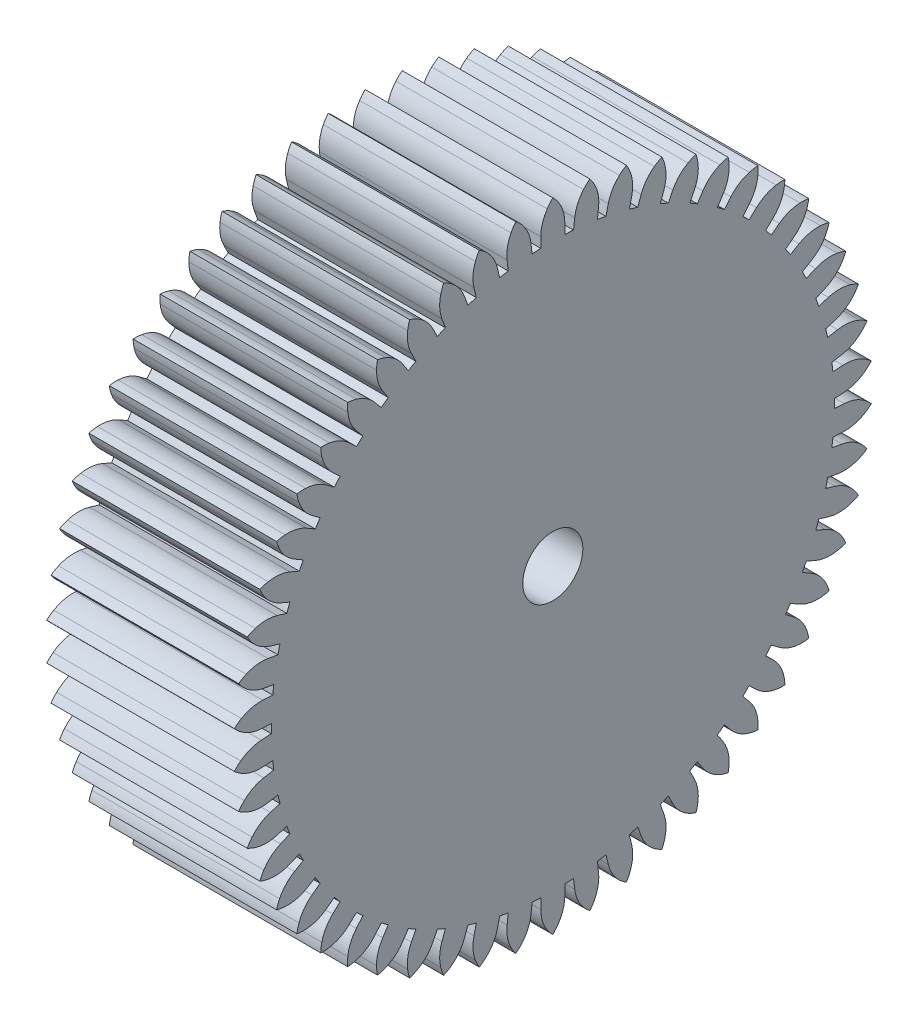
from build123d import *

# Parameters (mm, degrees)
BOSS_EXTRUDE1_DEPTH = 10
SKETCH2_R           = 1.6
CUT_EXTRUDE1_DEPTH  = 27.019664538


with BuildPart() as part:
    # Sketch1 → Boss-Extrude1 (new body)
    with BuildSketch(Plane(origin=(0, 0, 0), x_dir=(0, 0, -1), z_dir=(1, 0, 0))):
        with BuildLine():
            Line((-0.64, 14.986340447), (-0.64, 15.524222351))
            ThreePointArc((-0.64, 15.524222351), (-0.552634018, 16.1088856), (-0.298168885, 16.64246917))
            ThreePointArc((-0.298168885, 16.64246917), (-0.158190031, 16.828828344), (0, 17))
            ThreePointArc((0, 17), (0.158190031, 16.828828344), (0.298168885, 16.64246917))
            ThreePointArc((0.298168885, 16.64246917), (0.552634018, 16.1088856), (0.64, 15.524222351))
            Line((0.64, 15.524222351), (0.64, 14.986340447))
            ThreePointArc((0.64, 14.986340447), (0.872172434, 14.974622374), (1.104135386, 14.959307639))
            Line((1.104135386, 14.959307639), (1.166579663, 15.493552578))
            ThreePointArc((1.166579663, 15.493552578), (1.321230169, 16.064119972), (1.63591997, 16.564554042))
            ThreePointArc((1.63591997, 16.564554042), (1.796587317, 16.733402569), (1.97357954, 16.885052082))
            ThreePointArc((1.97357954, 16.885052082), (2.11082813, 16.696673086), (2.228225518, 16.495323452))
            ThreePointArc((2.228225518, 16.495323452), (2.419024777, 15.935806185), (2.437924761, 15.344953648))
            Line((2.437924761, 15.344953648), (2.375480484, 14.810708709))
            ThreePointArc((2.375480484, 14.810708709), (2.604722665, 14.772116295), (2.833339234, 14.729975858))
            Line((2.833339234, 14.729975858), (2.957383338, 15.253359085))
            ThreePointArc((2.957383338, 15.253359085), (3.177226983, 15.802114679), (3.547885815, 16.262631736))
            ThreePointArc((3.547885815, 16.262631736), (3.727068904, 16.41168623), (3.920469803, 16.5417628))
            ThreePointArc((3.920469803, 16.5417628), (4.0349209, 16.338723966), (4.128149223, 16.125106782))
            ThreePointArc((4.128149223, 16.125106782), (4.252702375, 15.547222328), (4.202880772, 14.958170771))
            Line((4.202880772, 14.958170771), (4.078836669, 14.434787544))
            ThreePointArc((4.078836669, 14.434787544), (4.302048491, 14.369842685), (4.52422703, 14.301446423))
            Line((4.52422703, 14.301446423), (4.708193476, 14.806890078))
            ThreePointArc((4.708193476, 14.806890078), (4.990257253, 15.326412893), (5.411872589, 15.740785235))
            ThreePointArc((5.411872589, 15.740785235), (5.607148278, 15.868029988), (5.814342437, 15.974774553))
            ThreePointArc((5.814342437, 15.974774553), (5.904448287, 15.759821634), (5.972246792, 15.536825706))
            ThreePointArc((5.972246792, 15.536825706), (6.02886947, 14.948388961), (5.911000031, 14.369104295))
            Line((5.911000031, 14.369104295), (5.727033585, 13.863660639))
            ThreePointArc((5.727033585, 13.863660639), (5.941196491, 13.773241603), (6.153932417, 13.679514458))
            Line((6.153932417, 13.679514458), (6.395333374, 14.160183284))
            ThreePointArc((6.395333374, 14.160183284), (6.735802855, 14.643447665), (7.202673072, 15.006071617))
            ThreePointArc((7.202673072, 15.006071617), (7.41140059, 15.109785863), (7.629586063, 15.191754885))
            ThreePointArc((7.629586063, 15.191754885), (7.694128139, 14.967794751), (7.735579968, 14.738435714))
            ThreePointArc((7.735579968, 14.738435714), (7.723506447, 14.147404277), (7.539183154, 13.585720333))
            Line((7.539183154, 13.585720333), (7.297782197, 13.105051507))
            ThreePointArc((7.297782197, 13.105051507), (7.5, 12.990381057), (7.700416425, 12.872590527))
            Line((7.700416425, 12.872590527), (7.99598736, 13.321984302))
            ThreePointArc((7.99598736, 13.321984302), (8.390258278, 13.762454928), (8.896069757, 14.068426623))
            ThreePointArc((8.896069757, 14.068426623), (9.115426423, 14.147207804), (9.341652627, 14.203292794))
            ThreePointArc((9.341652627, 14.203292794), (9.379758108, 13.97335412), (9.394302695, 13.740733664))
            ThreePointArc((9.394302695, 13.740733664), (9.31369625, 13.15510022), (9.065411759, 12.61861281))
            Line((9.065411759, 12.61861281), (8.769840823, 12.169219035))
            ThreePointArc((8.769840823, 12.169219035), (8.957378876, 12.031847891), (9.14276551, 11.891586892))
            Line((9.14276551, 11.891586892), (9.488509334, 12.303628336))
            ThreePointArc((9.488509334, 12.303628336), (9.931249851, 12.695348598), (10.469162359, 12.940530292))
            ThreePointArc((10.469162359, 12.940530292), (10.696181751, 12.993313029), (10.927389365, 13.022755533))
            ThreePointArc((10.927389365, 13.022755533), (10.938542939, 12.789947845), (10.925983595, 12.557211762))
            ThreePointArc((10.925983595, 12.557211762), (10.777934288, 11.984895999), (10.469046221, 11.480860195))
            Line((10.469046221, 11.480860195), (10.123302398, 11.068818752))
            ThreePointArc((10.123302398, 11.068818752), (10.293624568, 10.910604624), (10.461474377, 10.749769945))
            Line((10.461474377, 10.749769945), (10.852715496, 11.118886903))
            ThreePointArc((10.852715496, 11.118886903), (11.337938307, 11.456559456), (11.900677501, 11.637635489))
            ThreePointArc((11.900677501, 11.637635489), (12.13228957, 11.663705985), (12.365351907, 11.666107844))
            ThreePointArc((12.365351907, 11.666107844), (12.349402742, 11.433579468), (12.309909309, 11.203875113))
            ThreePointArc((12.309909309, 11.203875113), (12.096419254, 10.65261662), (11.731104792, 10.187848642))
            Line((11.731104792, 10.187848642), (11.339863673, 9.818731684))
            ThreePointArc((11.339863673, 9.818731684), (11.490666647, 9.641814145), (11.638709749, 9.4625808))
            Line((11.638709749, 9.4625808), (12.070157298, 9.7837816))
            ThreePointArc((12.070157298, 9.7837816), (12.591300597, 10.062840001), (13.171256394, 10.17736163))
            ThreePointArc((13.171256394, 10.17736163), (13.404328986, 10.176367326), (13.636094277, 10.151696059))
            ThreePointArc((13.636094277, 10.151696059), (13.593258058, 9.922591541), (13.527364617, 9.699025274))
            ThreePointArc((13.527364617, 9.699025274), (13.251320901, 9.176278876), (12.834520296, 8.757063913))
            Line((12.834520296, 8.757063913), (12.403072746, 8.435863113))
            ThreePointArc((12.403072746, 8.435863113), (12.532317171, 8.242634671), (12.658551537, 8.047426482))
            Line((12.658551537, 8.047426482), (13.12437093, 8.316367434))
            ThreePointArc((13.12437093, 8.316367434), (13.674387147, 8.533037898), (14.26371664, 8.579456414))
            ThreePointArc((14.26371664, 8.579456414), (14.495097847, 8.551410757), (14.722431864, 8.5))
            ThreePointArc((14.722431864, 8.5), (14.653287877, 8.277417587), (14.561885525, 8.063012756))
            ThreePointArc((14.561885525, 8.063012756), (14.227021165, 7.575847702), (13.76437093, 7.207854917))
            Line((13.76437093, 7.207854917), (13.298551537, 6.938913965))
            ThreePointArc((13.298551537, 6.938913965), (13.404489605, 6.731987703), (13.507208132, 6.523444527))
            Line((13.507208132, 6.523444527), (14.001099959, 6.736488665))
            ThreePointArc((14.001099959, 6.736488665), (14.572551069, 6.887841096), (15.163284588, 6.865528768))
            ThreePointArc((15.163284588, 6.865528768), (15.389845375, 6.810811027), (15.609673817, 6.733356023))
            ThreePointArc((15.609673817, 6.733356023), (15.515157116, 6.520305759), (15.399481912, 6.317961822))
            ThreePointArc((15.399481912, 6.317961822), (15.010325374, 5.872966183), (14.50808206, 5.561172048))
            Line((14.50808206, 5.561172048), (14.014190232, 5.34812791))
            ThreePointArc((14.014190232, 5.34812791), (14.095389312, 5.13030215), (14.173202907, 4.911244175))
            Line((14.173202907, 4.911244175), (14.68848813, 5.065510443))
            ThreePointArc((14.68848813, 5.065510443), (15.273646237, 5.149498058), (15.857795123, 5.058756623))
            ThreePointArc((15.857795123, 5.058756623), (16.076471646, 4.978106762), (16.285821709, 4.875654956))
            ThreePointArc((16.285821709, 4.875654956), (16.16721047, 4.675017981), (16.028826724, 4.487471293))
            ThreePointArc((16.028826724, 4.487471293), (15.590640682, 4.090662872), (15.055596268, 3.839283868))
            Line((15.055596268, 3.839283868), (14.540311045, 3.685017599))
            ThreePointArc((14.540311045, 3.685017599), (14.595673059, 3.459238061), (14.647529428, 3.23262767))
            Line((14.647529428, 3.23262767), (15.177239697, 3.326029883))
            ThreePointArc((15.177239697, 3.326029883), (15.768191541, 3.341516894), (16.337856184, 3.183573473))
            ThreePointArc((16.337856184, 3.183573473), (16.545691217, 3.078082143), (16.741731801, 2.95201902))
            ThreePointArc((16.741731801, 2.95201902), (16.600630038, 2.766508606), (16.441409151, 2.596295413))
            ThreePointArc((16.441409151, 2.596295413), (15.960119321, 2.253040364), (15.399509364, 2.065475959))
            Line((15.399509364, 2.065475959), (14.869799095, 1.972073747))
            ThreePointArc((14.869799095, 1.972073747), (14.898575366, 1.741393712), (14.923773241, 1.510295423))
            Line((14.923773241, 1.510295423), (15.460745133, 1.541570474))
            ThreePointArc((15.460745133, 1.541570474), (16.049499105, 1.488347445), (16.596975767, 1.265337953))
            ThreePointArc((16.596975767, 1.265337953), (16.791158698, 1.136431743), (16.971238691, 0.988462091))
            ThreePointArc((16.971238691, 0.988462091), (16.809554562, 0.820586947), (16.631649725, 0.670009092))
            ThreePointArc((16.631649725, 0.670009092), (16.113764725, 0.384949349), (15.535170514, 0.263736031))
            Line((15.535170514, 0.263736031), (14.998198622, 0.23246098))
            ThreePointArc((14.998198622, 0.23246098), (15, 0), (14.998198622, -0.23246098))
            Line((14.998198622, -0.23246098), (15.535170514, -0.263736031))
            ThreePointArc((15.535170514, -0.263736031), (16.113764725, -0.384949349), (16.631649725, -0.670009092))
            ThreePointArc((16.631649725, -0.670009092), (16.809554562, -0.820586947), (16.971238691, -0.988462091))
            ThreePointArc((16.971238691, -0.988462091), (16.791158698, -1.136431743), (16.596975767, -1.265337953))
            ThreePointArc((16.596975767, -1.265337953), (16.049499105, -1.488347445), (15.460745133, -1.541570474))
            Line((15.460745133, -1.541570474), (14.923773241, -1.510295423))
            ThreePointArc((14.923773241, -1.510295423), (14.898575366, -1.741393712), (14.869799095, -1.972073747))
            Line((14.869799095, -1.972073747), (15.399509364, -2.065475959))
            ThreePointArc((15.399509364, -2.065475959), (15.960119321, -2.253040364), (16.441409151, -2.596295413))
            ThreePointArc((16.441409151, -2.596295413), (16.600630038, -2.766508606), (16.741731801, -2.95201902))
            ThreePointArc((16.741731801, -2.95201902), (16.545691217, -3.078082143), (16.337856184, -3.183573473))
            ThreePointArc((16.337856184, -3.183573473), (15.768191541, -3.341516894), (15.177239697, -3.326029883))
            Line((15.177239697, -3.326029883), (14.647529428, -3.23262767))
            ThreePointArc((14.647529428, -3.23262767), (14.595673059, -3.459238061), (14.540311045, -3.685017599))
            Line((14.540311045, -3.685017599), (15.055596268, -3.839283868))
            ThreePointArc((15.055596268, -3.839283868), (15.590640682, -4.090662872), (16.028826724, -4.487471293))
            ThreePointArc((16.028826724, -4.487471293), (16.16721047, -4.675017981), (16.285821709, -4.875654956))
            ThreePointArc((16.285821709, -4.875654956), (16.076471646, -4.978106762), (15.857795123, -5.058756623))
            ThreePointArc((15.857795123, -5.058756623), (15.273646237, -5.149498058), (14.68848813, -5.065510443))
            Line((14.68848813, -5.065510443), (14.173202907, -4.911244175))
            ThreePointArc((14.173202907, -4.911244175), (14.095389312, -5.13030215), (14.014190232, -5.34812791))
            Line((14.014190232, -5.34812791), (14.50808206, -5.561172048))
            ThreePointArc((14.50808206, -5.561172048), (15.010325374, -5.872966183), (15.399481912, -6.317961822))
            ThreePointArc((15.399481912, -6.317961822), (15.515157116, -6.520305759), (15.609673817, -6.733356023))
            ThreePointArc((15.609673817, -6.733356023), (15.389845375, -6.810811027), (15.163284588, -6.865528768))
            ThreePointArc((15.163284588, -6.865528768), (14.572551069, -6.887841096), (14.001099959, -6.736488665))
            Line((14.001099959, -6.736488665), (13.507208132, -6.523444527))
            ThreePointArc((13.507208132, -6.523444527), (13.404489605, -6.731987703), (13.298551537, -6.938913965))
            Line((13.298551537, -6.938913965), (13.76437093, -7.207854917))
            ThreePointArc((13.76437093, -7.207854917), (14.227021165, -7.575847702), (14.561885525, -8.063012756))
            ThreePointArc((14.561885525, -8.063012756), (14.653287877, -8.277417587), (14.722431864, -8.5))
            ThreePointArc((14.722431864, -8.5), (14.495097847, -8.551410757), (14.26371664, -8.579456414))
            ThreePointArc((14.26371664, -8.579456414), (13.674387147, -8.533037898), (13.12437093, -8.316367434))
            Line((13.12437093, -8.316367434), (12.658551537, -8.047426482))
            ThreePointArc((12.658551537, -8.047426482), (12.532317171, -8.242634671), (12.403072746, -8.435863113))
            Line((12.403072746, -8.435863113), (12.834520296, -8.757063913))
            ThreePointArc((12.834520296, -8.757063913), (13.251320901, -9.176278876), (13.527364617, -9.699025274))
            ThreePointArc((13.527364617, -9.699025274), (13.593258058, -9.922591541), (13.636094277, -10.151696059))
            ThreePointArc((13.636094277, -10.151696059), (13.404328986, -10.176367326), (13.171256394, -10.17736163))
            ThreePointArc((13.171256394, -10.17736163), (12.591300597, -10.062840001), (12.070157298, -9.7837816))
            Line((12.070157298, -9.7837816), (11.638709749, -9.4625808))
            ThreePointArc((11.638709749, -9.4625808), (11.490666647, -9.641814145), (11.339863673, -9.818731684))
            Line((11.339863673, -9.818731684), (11.731104792, -10.187848642))
            ThreePointArc((11.731104792, -10.187848642), (12.096419254, -10.65261662), (12.309909309, -11.203875113))
            ThreePointArc((12.309909309, -11.203875113), (12.349402742, -11.433579468), (12.365351907, -11.666107844))
            ThreePointArc((12.365351907, -11.666107844), (12.13228957, -11.663705985), (11.900677501, -11.637635489))
            ThreePointArc((11.900677501, -11.637635489), (11.337938307, -11.456559456), (10.852715496, -11.118886903))
            Line((10.852715496, -11.118886903), (10.461474377, -10.749769945))
            ThreePointArc((10.461474377, -10.749769945), (10.293624568, -10.910604624), (10.123302398, -11.068818752))
            Line((10.123302398, -11.068818752), (10.469046221, -11.480860195))
            ThreePointArc((10.469046221, -11.480860195), (10.777934288, -11.984895999), (10.925983595, -12.557211762))
            ThreePointArc((10.925983595, -12.557211762), (10.938542939, -12.789947845), (10.927389365, -13.022755533))
            ThreePointArc((10.927389365, -13.022755533), (10.696181751, -12.993313029), (10.469162359, -12.940530292))
            ThreePointArc((10.469162359, -12.940530292), (9.931249851, -12.695348598), (9.488509334, -12.303628336))
            Line((9.488509334, -12.303628336), (9.14276551, -11.891586892))
            ThreePointArc((9.14276551, -11.891586892), (8.957378876, -12.031847891), (8.769840823, -12.169219035))
            Line((8.769840823, -12.169219035), (9.065411759, -12.61861281))
            ThreePointArc((9.065411759, -12.61861281), (9.31369625, -13.15510022), (9.394302695, -13.740733664))
            ThreePointArc((9.394302695, -13.740733664), (9.379758108, -13.97335412), (9.341652627, -14.203292794))
            ThreePointArc((9.341652627, -14.203292794), (9.115426423, -14.147207804), (8.896069757, -14.068426623))
            ThreePointArc((8.896069757, -14.068426623), (8.390258278, -13.762454928), (7.99598736, -13.321984302))
            Line((7.99598736, -13.321984302), (7.700416425, -12.872590527))
            ThreePointArc((7.700416425, -12.872590527), (7.5, -12.990381057), (7.297782197, -13.105051507))
            Line((7.297782197, -13.105051507), (7.539183154, -13.585720333))
            ThreePointArc((7.539183154, -13.585720333), (7.723506447, -14.147404277), (7.735579968, -14.738435714))
            ThreePointArc((7.735579968, -14.738435714), (7.694128139, -14.967794751), (7.629586063, -15.191754885))
            ThreePointArc((7.629586063, -15.191754885), (7.41140059, -15.109785863), (7.202673072, -15.006071617))
            ThreePointArc((7.202673072, -15.006071617), (6.735802855, -14.643447665), (6.395333374, -14.160183284))
            Line((6.395333374, -14.160183284), (6.153932417, -13.679514458))
            ThreePointArc((6.153932417, -13.679514458), (5.941196491, -13.773241603), (5.727033585, -13.863660639))
            Line((5.727033585, -13.863660639), (5.911000031, -14.369104295))
            ThreePointArc((5.911000031, -14.369104295), (6.02886947, -14.948388961), (5.972246792, -15.536825706))
            ThreePointArc((5.972246792, -15.536825706), (5.904448287, -15.759821634), (5.814342437, -15.974774553))
            ThreePointArc((5.814342437, -15.974774553), (5.607148278, -15.868029988), (5.411872589, -15.740785235))
            ThreePointArc((5.411872589, -15.740785235), (4.990257253, -15.326412893), (4.708193476, -14.806890078))
            Line((4.708193476, -14.806890078), (4.52422703, -14.301446423))
            ThreePointArc((4.52422703, -14.301446423), (4.302048491, -14.369842685), (4.078836669, -14.434787544))
            Line((4.078836669, -14.434787544), (4.202880772, -14.958170771))
            ThreePointArc((4.202880772, -14.958170771), (4.252702375, -15.547222328), (4.128149223, -16.125106782))
            ThreePointArc((4.128149223, -16.125106782), (4.0349209, -16.338723966), (3.920469803, -16.5417628))
            ThreePointArc((3.920469803, -16.5417628), (3.727068904, -16.41168623), (3.547885815, -16.262631736))
            ThreePointArc((3.547885815, -16.262631736), (3.177226983, -15.802114679), (2.957383338, -15.253359085))
            Line((2.957383338, -15.253359085), (2.833339234, -14.729975858))
            ThreePointArc((2.833339234, -14.729975858), (2.604722665, -14.772116295), (2.375480484, -14.810708709))
            Line((2.375480484, -14.810708709), (2.437924761, -15.344953648))
            ThreePointArc((2.437924761, -15.344953648), (2.419024777, -15.935806185), (2.228225518, -16.495323452))
            ThreePointArc((2.228225518, -16.495323452), (2.11082813, -16.696673086), (1.97357954, -16.885052082))
            ThreePointArc((1.97357954, -16.885052082), (1.796587317, -16.733402569), (1.63591997, -16.564554042))
            ThreePointArc((1.63591997, -16.564554042), (1.321230169, -16.064119972), (1.166579663, -15.493552578))
            Line((1.166579663, -15.493552578), (1.104135386, -14.959307639))
            ThreePointArc((1.104135386, -14.959307639), (0.872172434, -14.974622374), (0.64, -14.986340447))
            Line((0.64, -14.986340447), (0.64, -15.524222351))
            ThreePointArc((0.64, -15.524222351), (0.552634018, -16.1088856), (0.298168885, -16.64246917))
            ThreePointArc((0.298168885, -16.64246917), (0.158190031, -16.828828344), (0, -17))
            ThreePointArc((0, -17), (-0.158190031, -16.828828344), (-0.298168885, -16.64246917))
            ThreePointArc((-0.298168885, -16.64246917), (-0.552634018, -16.1088856), (-0.64, -15.524222351))
            Line((-0.64, -15.524222351), (-0.64, -14.986340447))
            ThreePointArc((-0.64, -14.986340447), (-0.872172434, -14.974622374), (-1.104135386, -14.959307639))
            Line((-1.104135386, -14.959307639), (-1.166579663, -15.493552578))
            ThreePointArc((-1.166579663, -15.493552578), (-1.321230169, -16.064119972), (-1.63591997, -16.564554042))
            ThreePointArc((-1.63591997, -16.564554042), (-1.796587317, -16.733402569), (-1.97357954, -16.885052082))
            ThreePointArc((-1.97357954, -16.885052082), (-2.11082813, -16.696673086), (-2.228225518, -16.495323452))
            ThreePointArc((-2.228225518, -16.495323452), (-2.419024777, -15.935806185), (-2.437924761, -15.344953648))
            Line((-2.437924761, -15.344953648), (-2.375480484, -14.810708709))
            ThreePointArc((-2.375480484, -14.810708709), (-2.604722665, -14.772116295), (-2.833339234, -14.729975858))
            Line((-2.833339234, -14.729975858), (-2.957383338, -15.253359085))
            ThreePointArc((-2.957383338, -15.253359085), (-3.177226983, -15.802114679), (-3.547885815, -16.262631736))
            ThreePointArc((-3.547885815, -16.262631736), (-3.727068904, -16.41168623), (-3.920469803, -16.5417628))
            ThreePointArc((-3.920469803, -16.5417628), (-4.0349209, -16.338723966), (-4.128149223, -16.125106782))
            ThreePointArc((-4.128149223, -16.125106782), (-4.252702375, -15.547222328), (-4.202880772, -14.958170771))
            Line((-4.202880772, -14.958170771), (-4.078836669, -14.434787544))
            ThreePointArc((-4.078836669, -14.434787544), (-4.302048491, -14.369842685), (-4.52422703, -14.301446423))
            Line((-4.52422703, -14.301446423), (-4.708193476, -14.806890078))
            ThreePointArc((-4.708193476, -14.806890078), (-4.990257253, -15.326412893), (-5.411872589, -15.740785235))
            ThreePointArc((-5.411872589, -15.740785235), (-5.607148278, -15.868029988), (-5.814342437, -15.974774553))
            ThreePointArc((-5.814342437, -15.974774553), (-5.904448287, -15.759821634), (-5.972246792, -15.536825706))
            ThreePointArc((-5.972246792, -15.536825706), (-6.02886947, -14.948388961), (-5.911000031, -14.369104295))
            Line((-5.911000031, -14.369104295), (-5.727033585, -13.863660639))
            ThreePointArc((-5.727033585, -13.863660639), (-5.941196491, -13.773241603), (-6.153932417, -13.679514458))
            Line((-6.153932417, -13.679514458), (-6.395333374, -14.160183284))
            ThreePointArc((-6.395333374, -14.160183284), (-6.735802855, -14.643447665), (-7.202673072, -15.006071617))
            ThreePointArc((-7.202673072, -15.006071617), (-7.41140059, -15.109785863), (-7.629586063, -15.191754885))
            ThreePointArc((-7.629586063, -15.191754885), (-7.694128139, -14.967794751), (-7.735579968, -14.738435714))
            ThreePointArc((-7.735579968, -14.738435714), (-7.723506447, -14.147404277), (-7.539183154, -13.585720333))
            Line((-7.539183154, -13.585720333), (-7.297782197, -13.105051507))
            ThreePointArc((-7.297782197, -13.105051507), (-7.5, -12.990381057), (-7.700416425, -12.872590527))
            Line((-7.700416425, -12.872590527), (-7.99598736, -13.321984302))
            ThreePointArc((-7.99598736, -13.321984302), (-8.390258278, -13.762454928), (-8.896069757, -14.068426623))
            ThreePointArc((-8.896069757, -14.068426623), (-9.115426423, -14.147207804), (-9.341652627, -14.203292794))
            ThreePointArc((-9.341652627, -14.203292794), (-9.379758108, -13.97335412), (-9.394302695, -13.740733664))
            ThreePointArc((-9.394302695, -13.740733664), (-9.31369625, -13.15510022), (-9.065411759, -12.61861281))
            Line((-9.065411759, -12.61861281), (-8.769840823, -12.169219035))
            ThreePointArc((-8.769840823, -12.169219035), (-8.957378876, -12.031847891), (-9.14276551, -11.891586892))
            Line((-9.14276551, -11.891586892), (-9.488509334, -12.303628336))
            ThreePointArc((-9.488509334, -12.303628336), (-9.931249851, -12.695348598), (-10.469162359, -12.940530292))
            ThreePointArc((-10.469162359, -12.940530292), (-10.696181751, -12.993313029), (-10.927389365, -13.022755533))
            ThreePointArc((-10.927389365, -13.022755533), (-10.938542939, -12.789947845), (-10.925983595, -12.557211762))
            ThreePointArc((-10.925983595, -12.557211762), (-10.777934288, -11.984895999), (-10.469046221, -11.480860195))
            Line((-10.469046221, -11.480860195), (-10.123302398, -11.068818752))
            ThreePointArc((-10.123302398, -11.068818752), (-10.293624568, -10.910604624), (-10.461474377, -10.749769945))
            Line((-10.461474377, -10.749769945), (-10.852715496, -11.118886903))
            ThreePointArc((-10.852715496, -11.118886903), (-11.337938307, -11.456559456), (-11.900677501, -11.637635489))
            ThreePointArc((-11.900677501, -11.637635489), (-12.13228957, -11.663705985), (-12.365351907, -11.666107844))
            ThreePointArc((-12.365351907, -11.666107844), (-12.349402742, -11.433579468), (-12.309909309, -11.203875113))
            ThreePointArc((-12.309909309, -11.203875113), (-12.096419254, -10.65261662), (-11.731104792, -10.187848642))
            Line((-11.731104792, -10.187848642), (-11.339863673, -9.818731684))
            ThreePointArc((-11.339863673, -9.818731684), (-11.490666647, -9.641814145), (-11.638709749, -9.4625808))
            Line((-11.638709749, -9.4625808), (-12.070157298, -9.7837816))
            ThreePointArc((-12.070157298, -9.7837816), (-12.591300597, -10.062840001), (-13.171256394, -10.17736163))
            ThreePointArc((-13.171256394, -10.17736163), (-13.404328986, -10.176367326), (-13.636094277, -10.151696059))
            ThreePointArc((-13.636094277, -10.151696059), (-13.593258058, -9.922591541), (-13.527364617, -9.699025274))
            ThreePointArc((-13.527364617, -9.699025274), (-13.251320901, -9.176278876), (-12.834520296, -8.757063913))
            Line((-12.834520296, -8.757063913), (-12.403072746, -8.435863113))
            ThreePointArc((-12.403072746, -8.435863113), (-12.532317171, -8.242634671), (-12.658551537, -8.047426482))
            Line((-12.658551537, -8.047426482), (-13.12437093, -8.316367434))
            ThreePointArc((-13.12437093, -8.316367434), (-13.674387147, -8.533037898), (-14.26371664, -8.579456414))
            ThreePointArc((-14.26371664, -8.579456414), (-14.495097847, -8.551410757), (-14.722431864, -8.5))
            ThreePointArc((-14.722431864, -8.5), (-14.653287877, -8.277417587), (-14.561885525, -8.063012756))
            ThreePointArc((-14.561885525, -8.063012756), (-14.227021165, -7.575847702), (-13.76437093, -7.207854917))
            Line((-13.76437093, -7.207854917), (-13.298551537, -6.938913965))
            ThreePointArc((-13.298551537, -6.938913965), (-13.404489605, -6.731987703), (-13.507208132, -6.523444527))
            Line((-13.507208132, -6.523444527), (-14.001099959, -6.736488665))
            ThreePointArc((-14.001099959, -6.736488665), (-14.572551069, -6.887841096), (-15.163284588, -6.865528768))
            ThreePointArc((-15.163284588, -6.865528768), (-15.389845375, -6.810811027), (-15.609673817, -6.733356023))
            ThreePointArc((-15.609673817, -6.733356023), (-15.515157116, -6.520305759), (-15.399481912, -6.317961822))
            ThreePointArc((-15.399481912, -6.317961822), (-15.010325374, -5.872966183), (-14.50808206, -5.561172048))
            Line((-14.50808206, -5.561172048), (-14.014190232, -5.34812791))
            ThreePointArc((-14.014190232, -5.34812791), (-14.095389312, -5.13030215), (-14.173202907, -4.911244175))
            Line((-14.173202907, -4.911244175), (-14.68848813, -5.065510443))
            ThreePointArc((-14.68848813, -5.065510443), (-15.273646237, -5.149498058), (-15.857795123, -5.058756623))
            ThreePointArc((-15.857795123, -5.058756623), (-16.076471646, -4.978106762), (-16.285821709, -4.875654956))
            ThreePointArc((-16.285821709, -4.875654956), (-16.16721047, -4.675017981), (-16.028826724, -4.487471293))
            ThreePointArc((-16.028826724, -4.487471293), (-15.590640682, -4.090662872), (-15.055596268, -3.839283868))
            Line((-15.055596268, -3.839283868), (-14.540311045, -3.685017599))
            ThreePointArc((-14.540311045, -3.685017599), (-14.595673059, -3.459238061), (-14.647529428, -3.23262767))
            Line((-14.647529428, -3.23262767), (-15.177239697, -3.326029883))
            ThreePointArc((-15.177239697, -3.326029883), (-15.768191541, -3.341516894), (-16.337856184, -3.183573473))
            ThreePointArc((-16.337856184, -3.183573473), (-16.545691217, -3.078082143), (-16.741731801, -2.95201902))
            ThreePointArc((-16.741731801, -2.95201902), (-16.600630038, -2.766508606), (-16.441409151, -2.596295413))
            ThreePointArc((-16.441409151, -2.596295413), (-15.960119321, -2.253040364), (-15.399509364, -2.065475959))
            Line((-15.399509364, -2.065475959), (-14.869799095, -1.972073747))
            ThreePointArc((-14.869799095, -1.972073747), (-14.898575366, -1.741393712), (-14.923773241, -1.510295423))
            Line((-14.923773241, -1.510295423), (-15.460745133, -1.541570474))
            ThreePointArc((-15.460745133, -1.541570474), (-16.049499105, -1.488347445), (-16.596975767, -1.265337953))
            ThreePointArc((-16.596975767, -1.265337953), (-16.791158698, -1.136431743), (-16.971238691, -0.988462091))
            ThreePointArc((-16.971238691, -0.988462091), (-16.809554562, -0.820586947), (-16.631649725, -0.670009092))
            ThreePointArc((-16.631649725, -0.670009092), (-16.113764725, -0.384949349), (-15.535170514, -0.263736031))
            Line((-15.535170514, -0.263736031), (-14.998198622, -0.23246098))
            ThreePointArc((-14.998198622, -0.23246098), (-15, 0), (-14.998198622, 0.23246098))
            Line((-14.998198622, 0.23246098), (-15.535170514, 0.263736031))
            ThreePointArc((-15.535170514, 0.263736031), (-16.113764725, 0.384949349), (-16.631649725, 0.670009092))
            ThreePointArc((-16.631649725, 0.670009092), (-16.809554562, 0.820586947), (-16.971238691, 0.988462091))
            ThreePointArc((-16.971238691, 0.988462091), (-16.791158698, 1.136431743), (-16.596975767, 1.265337953))
            ThreePointArc((-16.596975767, 1.265337953), (-16.049499105, 1.488347445), (-15.460745133, 1.541570474))
            Line((-15.460745133, 1.541570474), (-14.923773241, 1.510295423))
            ThreePointArc((-14.923773241, 1.510295423), (-14.898575366, 1.741393712), (-14.869799095, 1.972073747))
            Line((-14.869799095, 1.972073747), (-15.399509364, 2.065475959))
            ThreePointArc((-15.399509364, 2.065475959), (-15.960119321, 2.253040364), (-16.441409151, 2.596295413))
            ThreePointArc((-16.441409151, 2.596295413), (-16.600630038, 2.766508606), (-16.741731801, 2.95201902))
            ThreePointArc((-16.741731801, 2.95201902), (-16.545691217, 3.078082143), (-16.337856184, 3.183573473))
            ThreePointArc((-16.337856184, 3.183573473), (-15.768191541, 3.341516894), (-15.177239697, 3.326029883))
            Line((-15.177239697, 3.326029883), (-14.647529428, 3.23262767))
            ThreePointArc((-14.647529428, 3.23262767), (-14.595673059, 3.459238061), (-14.540311045, 3.685017599))
            Line((-14.540311045, 3.685017599), (-15.055596268, 3.839283868))
            ThreePointArc((-15.055596268, 3.839283868), (-15.590640682, 4.090662872), (-16.028826724, 4.487471293))
            ThreePointArc((-16.028826724, 4.487471293), (-16.16721047, 4.675017981), (-16.285821709, 4.875654956))
            ThreePointArc((-16.285821709, 4.875654956), (-16.076471646, 4.978106762), (-15.857795123, 5.058756623))
            ThreePointArc((-15.857795123, 5.058756623), (-15.273646237, 5.149498058), (-14.68848813, 5.065510443))
            Line((-14.68848813, 5.065510443), (-14.173202907, 4.911244175))
            ThreePointArc((-14.173202907, 4.911244175), (-14.095389312, 5.13030215), (-14.014190232, 5.34812791))
            Line((-14.014190232, 5.34812791), (-14.50808206, 5.561172048))
            ThreePointArc((-14.50808206, 5.561172048), (-15.010325374, 5.872966183), (-15.399481912, 6.317961822))
            ThreePointArc((-15.399481912, 6.317961822), (-15.515157116, 6.520305759), (-15.609673817, 6.733356023))
            ThreePointArc((-15.609673817, 6.733356023), (-15.389845375, 6.810811027), (-15.163284588, 6.865528768))
            ThreePointArc((-15.163284588, 6.865528768), (-14.572551069, 6.887841096), (-14.001099959, 6.736488665))
            Line((-14.001099959, 6.736488665), (-13.507208132, 6.523444527))
            ThreePointArc((-13.507208132, 6.523444527), (-13.404489605, 6.731987703), (-13.298551537, 6.938913965))
            Line((-13.298551537, 6.938913965), (-13.76437093, 7.207854917))
            ThreePointArc((-13.76437093, 7.207854917), (-14.227021165, 7.575847702), (-14.561885525, 8.063012756))
            ThreePointArc((-14.561885525, 8.063012756), (-14.653287877, 8.277417587), (-14.722431864, 8.5))
            ThreePointArc((-14.722431864, 8.5), (-14.495097847, 8.551410757), (-14.26371664, 8.579456414))
            ThreePointArc((-14.26371664, 8.579456414), (-13.674387147, 8.533037898), (-13.12437093, 8.316367434))
            Line((-13.12437093, 8.316367434), (-12.658551537, 8.047426482))
            ThreePointArc((-12.658551537, 8.047426482), (-12.532317171, 8.242634671), (-12.403072746, 8.435863113))
            Line((-12.403072746, 8.435863113), (-12.834520296, 8.757063913))
            ThreePointArc((-12.834520296, 8.757063913), (-13.251320901, 9.176278876), (-13.527364617, 9.699025274))
            ThreePointArc((-13.527364617, 9.699025274), (-13.593258058, 9.922591541), (-13.636094277, 10.151696059))
            ThreePointArc((-13.636094277, 10.151696059), (-13.404328986, 10.176367326), (-13.171256394, 10.17736163))
            ThreePointArc((-13.171256394, 10.17736163), (-12.591300597, 10.062840001), (-12.070157298, 9.7837816))
            Line((-12.070157298, 9.7837816), (-11.638709749, 9.4625808))
            ThreePointArc((-11.638709749, 9.4625808), (-11.490666647, 9.641814145), (-11.339863673, 9.818731684))
            Line((-11.339863673, 9.818731684), (-11.731104792, 10.187848642))
            ThreePointArc((-11.731104792, 10.187848642), (-12.096419254, 10.65261662), (-12.309909309, 11.203875113))
            ThreePointArc((-12.309909309, 11.203875113), (-12.349402742, 11.433579468), (-12.365351907, 11.666107844))
            ThreePointArc((-12.365351907, 11.666107844), (-12.13228957, 11.663705985), (-11.900677501, 11.637635489))
            ThreePointArc((-11.900677501, 11.637635489), (-11.337938307, 11.456559456), (-10.852715496, 11.118886903))
            Line((-10.852715496, 11.118886903), (-10.461474377, 10.749769945))
            ThreePointArc((-10.461474377, 10.749769945), (-10.293624568, 10.910604624), (-10.123302398, 11.068818752))
            Line((-10.123302398, 11.068818752), (-10.469046221, 11.480860195))
            ThreePointArc((-10.469046221, 11.480860195), (-10.777934288, 11.984895999), (-10.925983595, 12.557211762))
            ThreePointArc((-10.925983595, 12.557211762), (-10.938542939, 12.789947845), (-10.927389365, 13.022755533))
            ThreePointArc((-10.927389365, 13.022755533), (-10.696181751, 12.993313029), (-10.469162359, 12.940530292))
            ThreePointArc((-10.469162359, 12.940530292), (-9.931249851, 12.695348598), (-9.488509334, 12.303628336))
            Line((-9.488509334, 12.303628336), (-9.14276551, 11.891586892))
            ThreePointArc((-9.14276551, 11.891586892), (-8.957378876, 12.031847891), (-8.769840823, 12.169219035))
            Line((-8.769840823, 12.169219035), (-9.065411759, 12.61861281))
            ThreePointArc((-9.065411759, 12.61861281), (-9.31369625, 13.15510022), (-9.394302695, 13.740733664))
            ThreePointArc((-9.394302695, 13.740733664), (-9.379758108, 13.97335412), (-9.341652627, 14.203292794))
            ThreePointArc((-9.341652627, 14.203292794), (-9.115426423, 14.147207804), (-8.896069757, 14.068426623))
            ThreePointArc((-8.896069757, 14.068426623), (-8.390258278, 13.762454928), (-7.99598736, 13.321984302))
            Line((-7.99598736, 13.321984302), (-7.700416425, 12.872590527))
            ThreePointArc((-7.700416425, 12.872590527), (-7.5, 12.990381057), (-7.297782197, 13.105051507))
            Line((-7.297782197, 13.105051507), (-7.539183154, 13.585720333))
            ThreePointArc((-7.539183154, 13.585720333), (-7.723506447, 14.147404277), (-7.735579968, 14.738435714))
            ThreePointArc((-7.735579968, 14.738435714), (-7.694128139, 14.967794751), (-7.629586063, 15.191754885))
            ThreePointArc((-7.629586063, 15.191754885), (-7.41140059, 15.109785863), (-7.202673072, 15.006071617))
            ThreePointArc((-7.202673072, 15.006071617), (-6.735802855, 14.643447665), (-6.395333374, 14.160183284))
            Line((-6.395333374, 14.160183284), (-6.153932417, 13.679514458))
            ThreePointArc((-6.153932417, 13.679514458), (-5.941196491, 13.773241603), (-5.727033585, 13.863660639))
            Line((-5.727033585, 13.863660639), (-5.911000031, 14.369104295))
            ThreePointArc((-5.911000031, 14.369104295), (-6.02886947, 14.948388961), (-5.972246792, 15.536825706))
            ThreePointArc((-5.972246792, 15.536825706), (-5.904448287, 15.759821634), (-5.814342437, 15.974774553))
            ThreePointArc((-5.814342437, 15.974774553), (-5.607148278, 15.868029988), (-5.411872589, 15.740785235))
            ThreePointArc((-5.411872589, 15.740785235), (-4.990257253, 15.326412893), (-4.708193476, 14.806890078))
            Line((-4.708193476, 14.806890078), (-4.52422703, 14.301446423))
            ThreePointArc((-4.52422703, 14.301446423), (-4.302048491, 14.369842685), (-4.078836669, 14.434787544))
            Line((-4.078836669, 14.434787544), (-4.202880772, 14.958170771))
            ThreePointArc((-4.202880772, 14.958170771), (-4.252702375, 15.547222328), (-4.128149223, 16.125106782))
            ThreePointArc((-4.128149223, 16.125106782), (-4.0349209, 16.338723966), (-3.920469803, 16.5417628))
            ThreePointArc((-3.920469803, 16.5417628), (-3.727068904, 16.41168623), (-3.547885815, 16.262631736))
            ThreePointArc((-3.547885815, 16.262631736), (-3.177226983, 15.802114679), (-2.957383338, 15.253359085))
            Line((-2.957383338, 15.253359085), (-2.833339234, 14.729975858))
            ThreePointArc((-2.833339234, 14.729975858), (-2.604722665, 14.772116295), (-2.375480484, 14.810708709))
            Line((-2.375480484, 14.810708709), (-2.437924761, 15.344953648))
            ThreePointArc((-2.437924761, 15.344953648), (-2.419024777, 15.935806185), (-2.228225518, 16.495323452))
            ThreePointArc((-2.228225518, 16.495323452), (-2.11082813, 16.696673086), (-1.97357954, 16.885052082))
            ThreePointArc((-1.97357954, 16.885052082), (-1.796587317, 16.733402569), (-1.63591997, 16.564554042))
            ThreePointArc((-1.63591997, 16.564554042), (-1.321230169, 16.064119972), (-1.166579663, 15.493552578))
            Line((-1.166579663, 15.493552578), (-1.104135386, 14.959307639))
            ThreePointArc((-1.104135386, 14.959307639), (-0.872172434, 14.974622374), (-0.64, 14.986340447))
        make_face()
    extrude(amount=BOSS_EXTRUDE1_DEPTH)

    # Sketch2 → Cut-Extrude1 (cut, through all)
    with BuildSketch(Plane(origin=(10, 0, 0), x_dir=(0, 0, -1), z_dir=(1, 0, 0))):
        Circle(SKETCH2_R)
    extrude(amount=-CUT_EXTRUDE1_DEPTH, mode=Mode.SUBTRACT)


solid = part.part
